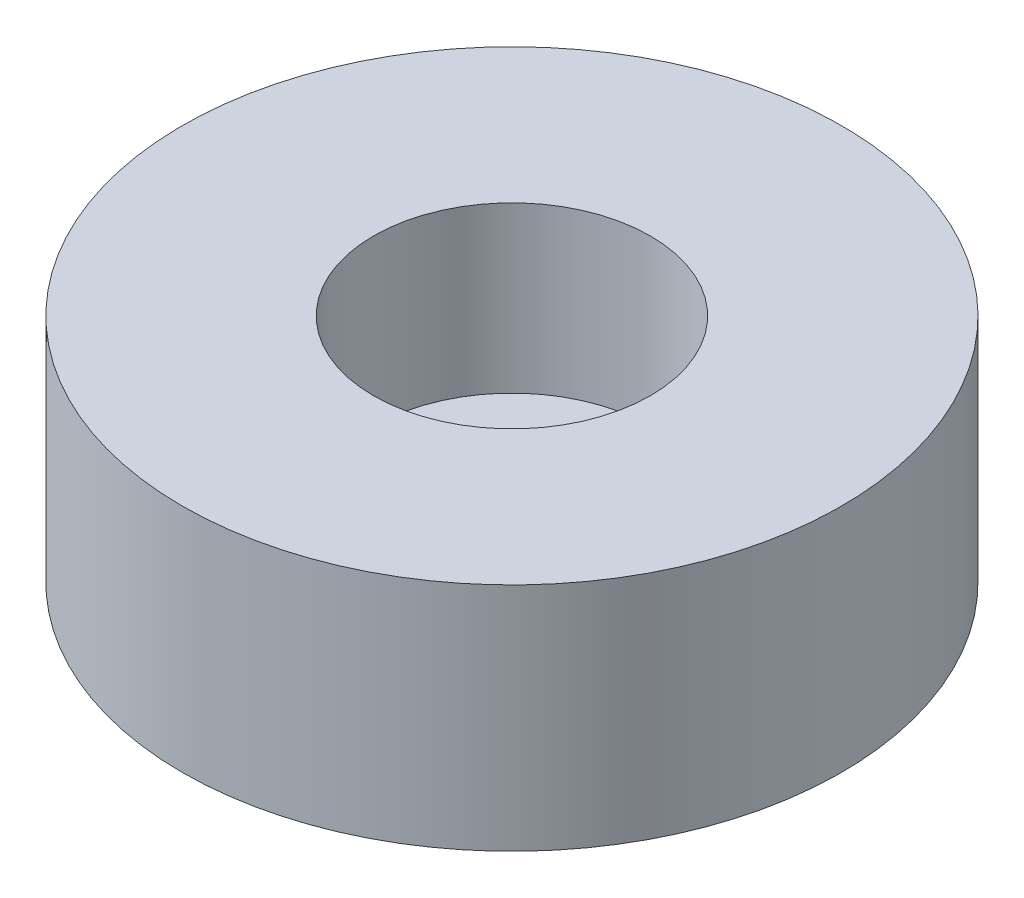
from build123d import *

# Parameters (mm, degrees)
SKETCH1_R           = 10
SKETCH1_R_2         = 4.2
BOSS_EXTRUDE1_DEPTH = 5
BOSS_EXTRUDE2_START = -2
SKETCH1_2_R         = 10
BOSS_EXTRUDE2_DEPTH = 2


with BuildPart() as part:
    # Sketch1 → Boss-Extrude1 (new body)
    with BuildSketch(Plane(origin=(0, 0, 0), x_dir=(1, 0, 0), z_dir=(0, 1, 0))):
        Circle(SKETCH1_R)
        Circle(SKETCH1_R_2, mode=Mode.SUBTRACT)
    extrude(amount=BOSS_EXTRUDE1_DEPTH)

    # Sketch1<2> → Boss-Extrude2 (add)
    with BuildSketch(Plane(origin=(0, 0, 0), x_dir=(1, 0, 0), z_dir=(0, 1, 0)).offset(BOSS_EXTRUDE2_START)):
        Circle(SKETCH1_2_R)
    extrude(amount=BOSS_EXTRUDE2_DEPTH)


solid = part.part
